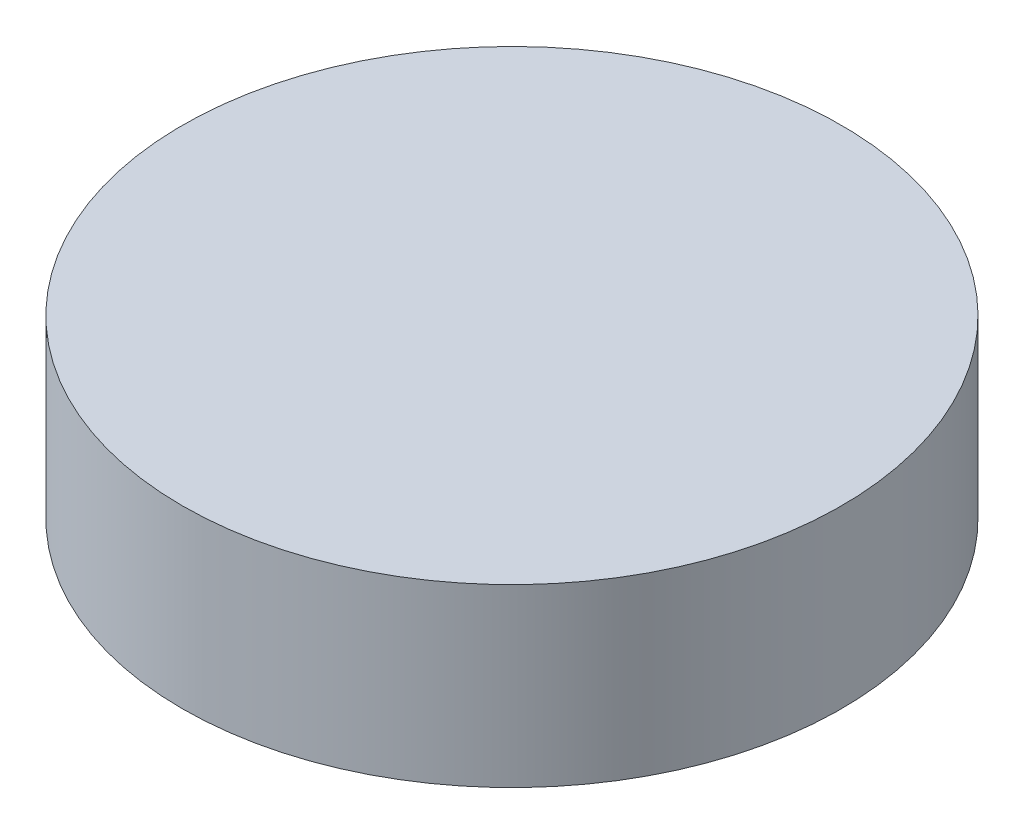
from build123d import *

# Parameters (mm, degrees)
SKETCH1_R           = 9.525
BOSS_EXTRUDE1_DEPTH = 5.08
SKETCH2_R           = 2.8702
CUT_EXTRUDE1_DEPTH  = 2.54


with BuildPart() as part:
    # Sketch1 → Boss-Extrude1 (new body)
    with BuildSketch(Plane(origin=(0, 0, 0), x_dir=(1, 0, 0), z_dir=(0, 1, 0))):
        with Locations(Location((0, 0, 0), (0, 0, 270))):
            Circle(SKETCH1_R)
    extrude(amount=BOSS_EXTRUDE1_DEPTH)

    # Sketch2 → Cut-Extrude1 (cut)
    with BuildSketch(Plane.XZ):
        with Locations(Location((0, 0, 0), (0, 0, 270))):
            Circle(SKETCH2_R)
    extrude(amount=-CUT_EXTRUDE1_DEPTH, mode=Mode.SUBTRACT)


solid = part.part
